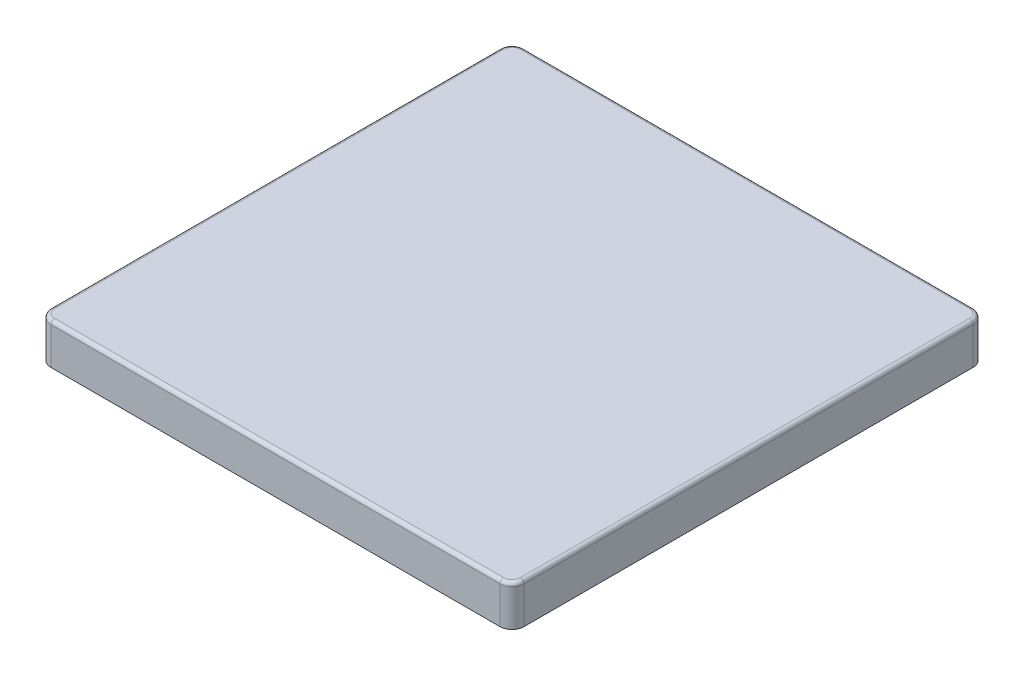
from build123d import *

# Parameters (mm, degrees)
SKETCH1_W           = 100
SKETCH1_H           = 100
BOSS_EXTRUDE1_DEPTH = 8.6
FILLET1_R           = 2.54
FILLET2_R           = 0.762


with BuildPart() as part:
    # Sketch1 → Boss-Extrude1 (new body)
    with BuildSketch(Plane(origin=(0, 0, 0), x_dir=(1, 0, 0), z_dir=(0, 1, 0))):
        with Locations((50, 50)):
            Rectangle(SKETCH1_W, SKETCH1_H)
    extrude(amount=BOSS_EXTRUDE1_DEPTH)

    # Fillet1
    fillet1_edges = [part.edges().sort_by_distance(p)[0] for p in [
        (0, 4.3, -100),
        (100, 4.3, -100),
        (100, 4.3, 0),
        (0, 4.3, 0),
    ]]
    fillet(fillet1_edges, radius=FILLET1_R)

    # Fillet2
    fillet2_edges = [part.edges().sort_by_distance(p)[0] for p in [
        (100, 8.6, -50),
        (50, 8.6, 0),
        (0, 8.6, -50),
        (50, 8.6, -100),
        (0.743948776, 8.6, -0.743948776),
        (0.743948776, 8.6, -99.256051224),
        (99.256051224, 8.6, -99.256051224),
        (99.256051224, 8.6, -0.743948776),
    ]]
    fillet(fillet2_edges, radius=FILLET2_R)


solid = part.part
